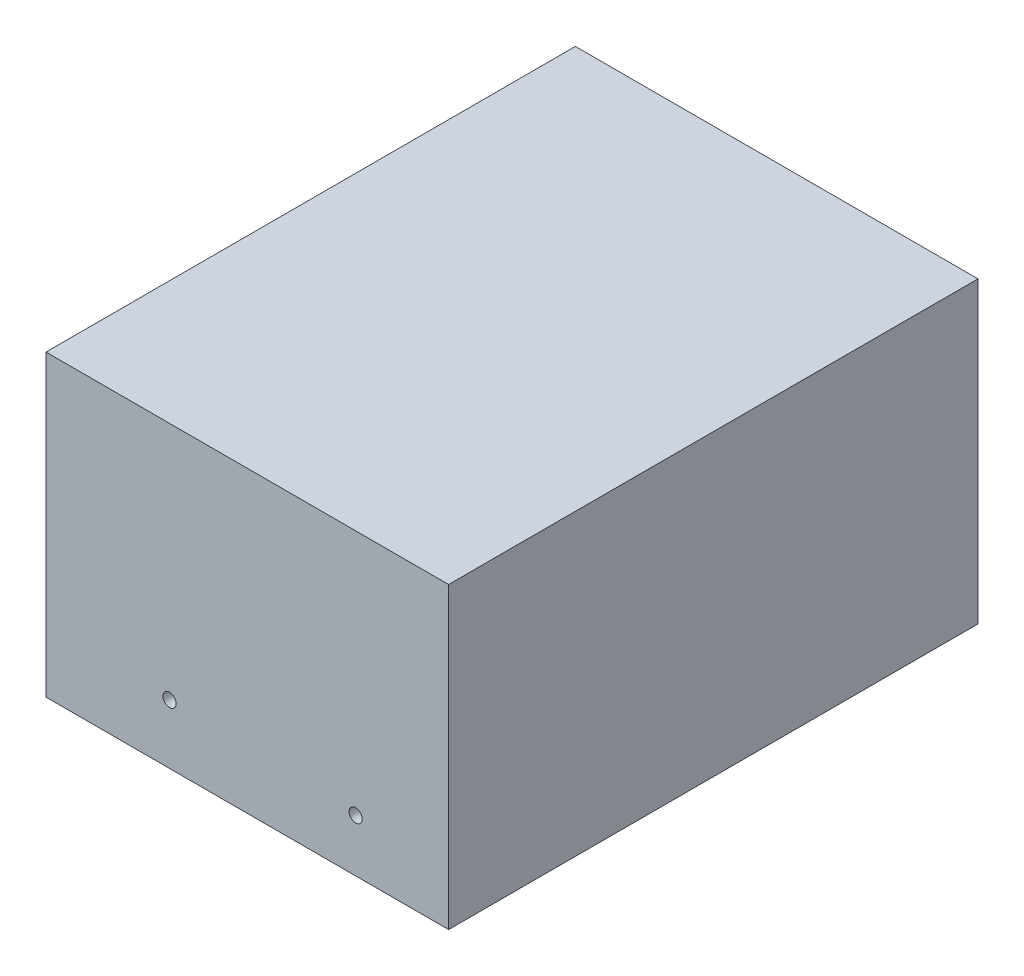
from build123d import *

# Parameters (mm, degrees)
SKETCH1_W           = 48.9
SKETCH1_H           = 36.3
BOSS_EXTRUDE1_DEPTH = 26
CUT_EXTRUDE1_DEPTH  = 24.5
SKETCH4_W           = 2.15
SKETCH4_H           = 2.35
BOSS_EXTRUDE3_DEPTH = 24.5
SKETCH5_W           = 26.82
SKETCH5_H           = 2.95
BOSS_EXTRUDE4_DEPTH = 16.12
SKETCH6_W           = 4.57
SKETCH6_H           = 0.74
SKETCH6_W_2         = 8
CUT_EXTRUDE2_DEPTH  = 16.12
SKETCH7_W           = 38.3
SKETCH7_H           = 36.3
BOSS_EXTRUDE5_DEPTH = 48.9
SKETCH8_R           = 0.9
CUT_EXTRUDE3_DEPTH  = 11.45
SKETCH9_R           = 0.8
CUT_EXTRUDE4_DEPTH  = 71.719887585


with BuildPart() as part:
    # Sketch1 → Boss-Extrude1 (new body)
    with BuildSketch(Plane.XY):
        with Locations((24.45, -18.15)):
            Rectangle(SKETCH1_W, SKETCH1_H)
    extrude(amount=BOSS_EXTRUDE1_DEPTH)

    # Sketch3 → Cut-Extrude1 (cut)
    with BuildSketch(Plane(origin=(0, 0, 0), x_dir=(-1, 0, 0), z_dir=(0, 0, -1))):
        Polygon((-24.45, -1.98), (-46.92, -1.98), (-46.92, -34.32), (-1.98, -34.32), (-1.98, -1.98), align=None)
    extrude(amount=-CUT_EXTRUDE1_DEPTH, mode=Mode.SUBTRACT)

    # Sketch4 → Boss-Extrude3 (add)
    with BuildSketch(Plane(origin=(0, 0, 24.5), x_dir=(-1, 0, 0), z_dir=(0, 0, -1))):
        with Locations((-38.585, -3.155)):
            Rectangle(SKETCH4_W, SKETCH4_H)
        with Locations((-29.485, -3.155)):
            Rectangle(SKETCH4_W, SKETCH4_H)
        with Locations((-20.385, -3.155)):
            Rectangle(SKETCH4_W, SKETCH4_H)
        with Locations((-11.285, -3.155)):
            Rectangle(SKETCH4_W, SKETCH4_H)
    extrude(amount=BOSS_EXTRUDE3_DEPTH)

    # Sketch5 → Boss-Extrude4 (add)
    with BuildSketch(Plane(origin=(0, 0, 24.5), x_dir=(-1, 0, 0), z_dir=(0, 0, -1))):
        with Locations((-24.45, -18.845)):
            Rectangle(SKETCH5_W, SKETCH5_H)
    extrude(amount=BOSS_EXTRUDE4_DEPTH)

    # Sketch6 → Cut-Extrude2 (cut)
    with BuildSketch(Plane(origin=(0, 0, 8.38), x_dir=(-1, 0, 0), z_dir=(0, 0, -1))):
        with Locations((-33.205, -19.95)):
            Rectangle(SKETCH6_W, SKETCH6_H)
        with Locations((-24.55, -19.95)):
            Rectangle(SKETCH6_W_2, SKETCH6_H)
        with Locations((-15.695, -19.95)):
            Rectangle(SKETCH6_W, SKETCH6_H)
        with Locations((-15.695, -17.74)):
            Rectangle(SKETCH6_W, SKETCH6_H)
        with Locations((-24.55, -17.74)):
            Rectangle(SKETCH6_W_2, SKETCH6_H)
        with Locations((-33.205, -17.74)):
            Rectangle(SKETCH6_W, SKETCH6_H)
    extrude(amount=-CUT_EXTRUDE2_DEPTH, mode=Mode.SUBTRACT)

    # Sketch7 → Boss-Extrude5 (add)
    with BuildSketch(Plane(origin=(48.9, 0, 0), x_dir=(0, 0, -1), z_dir=(1, 0, 0))):
        with Locations((-45.15, -18.15)):
            Rectangle(SKETCH7_W, SKETCH7_H)
    extrude(amount=-BOSS_EXTRUDE5_DEPTH)

    # Sketch8 → Cut-Extrude3 (cut)
    with BuildSketch(Plane(origin=(0, 0, 24.5), x_dir=(-1, 0, 0), z_dir=(0, 0, -1))):
        with Locations((-37.61143404, -29.928818747)):
            Circle(SKETCH8_R)
        with Locations((-15.010991749, -29.088008467)):
            Circle(SKETCH8_R)
    extrude(amount=-CUT_EXTRUDE3_DEPTH, mode=Mode.SUBTRACT)

    # Sketch9 → Cut-Extrude4 (cut, through all)
    with BuildSketch(Plane(origin=(0, 0, 35.95), x_dir=(-1, 0, 0), z_dir=(0, 0, -1))):
        with Locations((-37.61143404, -29.928818747)):
            Circle(SKETCH9_R)
        with Locations((-15.010991749, -29.088008467)):
            Circle(SKETCH9_R)
    extrude(amount=-CUT_EXTRUDE4_DEPTH, mode=Mode.SUBTRACT)


solid = part.part
